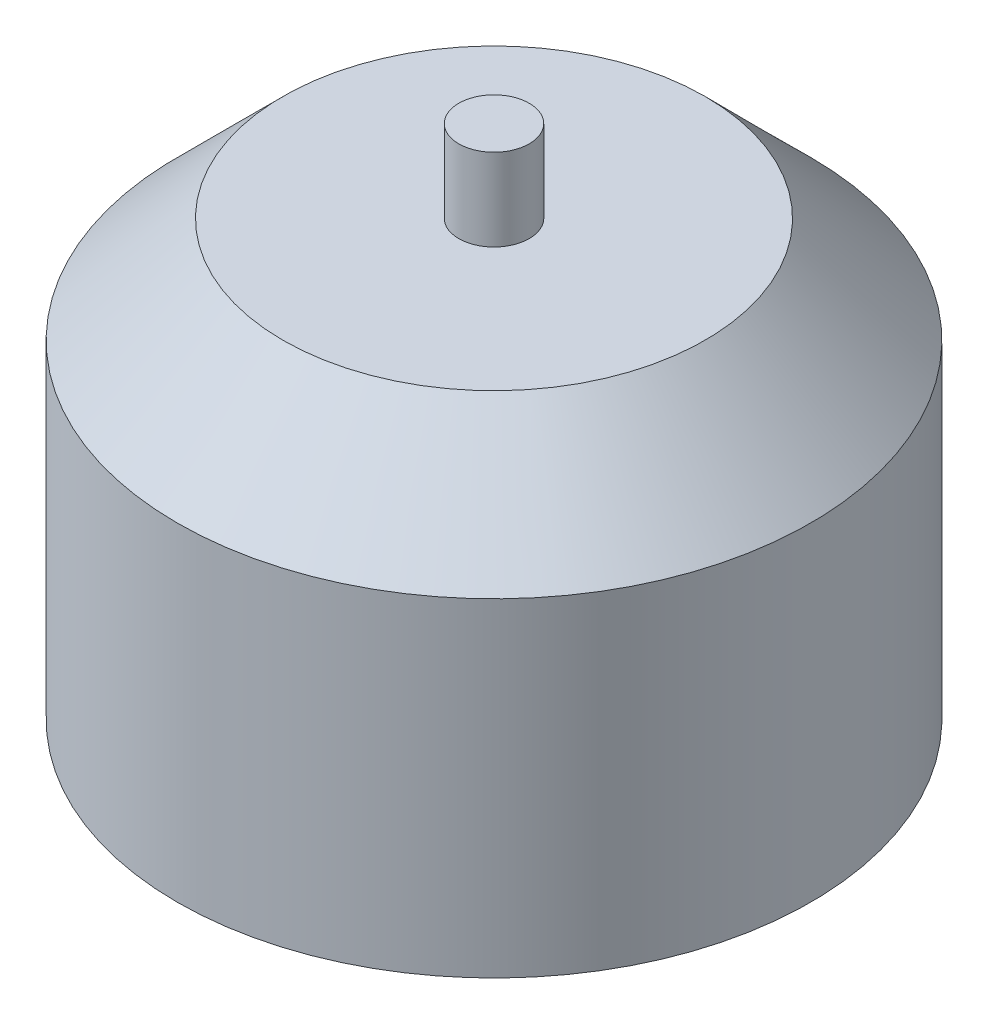
from build123d import *

# Parameters (mm, degrees)
SKETCH1_R                = 13.5
BOSS_EXTRUDE1_DEPTH      = 18.5
BOSS_EXTRUDE2_DEPTH      = 3.5
BOSS_EXTRUDE2_DEPTH_BACK = 21.5
SKETCH3_R                = 1.5


with BuildPart() as part:
    # Sketch1 → Boss-Extrude1 (new body)
    with BuildSketch(Plane(origin=(0, 0, 0), x_dir=(1, 0, 0), z_dir=(0, 1, 0))):
        with Locations(Location((0, 0, 0), (0, 0, 270))):
            Circle(SKETCH1_R)
    extrude(amount=BOSS_EXTRUDE1_DEPTH)

    # Sketch2 → Cut-Revolve1 (revolve, cut)
    with BuildSketch(Plane.XY, mode=Mode.PRIVATE) as cut_revolve1_sk:
        Polygon((-13.5, 14), (-9, 18.5), (-13.5, 18.5), align=None)
    revolve(cut_revolve1_sk.sketch.rotate(Axis((0, 18.5, 0), (0, -1, 0)), 270), axis=Axis((0, 18.5, 0), (0, -1, 0)), mode=Mode.SUBTRACT)

    # Sketch3 → Boss-Extrude2 (add, two sides: drawn at the far end of the back side and taken through both)
    with BuildSketch(Plane(origin=(0, 18.5, 0), x_dir=(1, 0, 0), z_dir=(0, 1, 0)).offset(-BOSS_EXTRUDE2_DEPTH_BACK)):
        with Locations(Location((0, 0, 0), (0, 0, 270))):
            Circle(SKETCH3_R)
    extrude(amount=BOSS_EXTRUDE2_DEPTH + BOSS_EXTRUDE2_DEPTH_BACK)


solid = part.part
